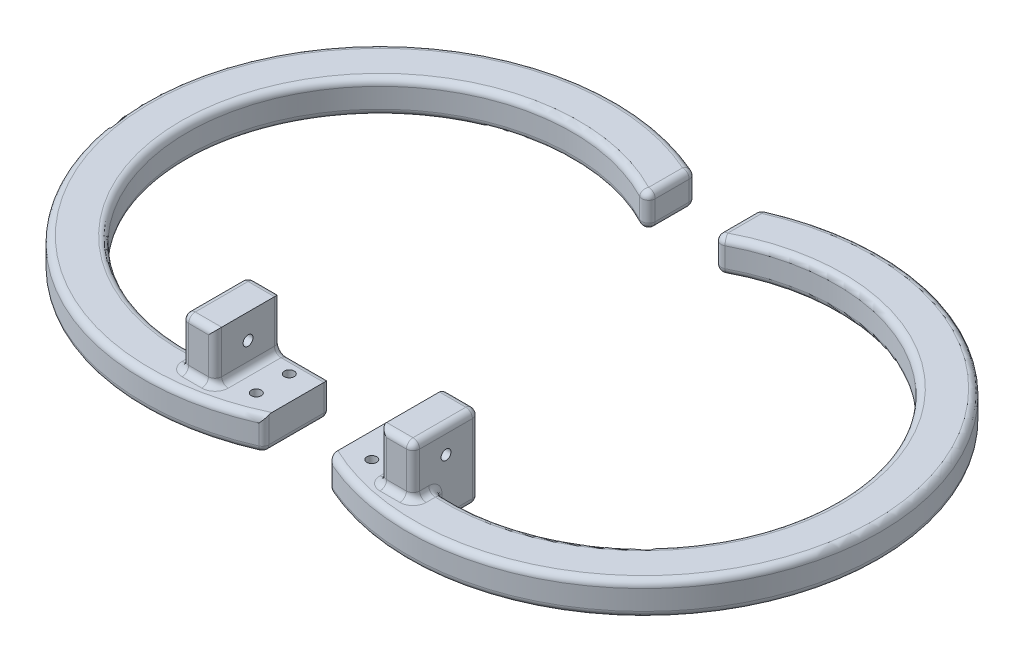
from build123d import *

# Parameters (mm, degrees)
BOSS_EXTRUDE1_DEPTH  = 10
SKETCH2_W            = 20
SKETCH2_H            = 10
BOSS_EXTRUDE2_DEPTH  = 15
SKETCH3_W            = 20
SKETCH3_H            = 15
BOSS_EXTRUDE10_DEPTH = 10
SKETCH4_W            = 10
SKETCH4_H            = 20
BOSS_EXTRUDE11_DEPTH = 10
FILLET2_R            = 2
SKETCH5_R            = 1.5
CUT_EXTRUDE1_DEPTH   = 112.385735788
CUT_EXTRUDE2_REACH   = 115.348
SKETCH6_R            = 1.5


with BuildPart() as part:
    # Sketch1 → Boss-Extrude1 (new body)
    with BuildSketch(Plane(origin=(0, 0, 0), x_dir=(1, 0, 0), z_dir=(0, 1, 0))):
        with BuildLine():
            Line((-20, 50), (-20, 65))
            ThreePointArc((-20, 65), (81.589105316, 0), (-20, -65))
            Line((-20, -65), (-20, -50))
            ThreePointArc((-20, -50), (68.309518948, 0), (-20, 50))
        make_face()
    extrude(amount=-BOSS_EXTRUDE1_DEPTH)

    # Sketch2 → Boss-Extrude2 (add)
    with BuildSketch(Plane.ZY.offset(20)):
        with Locations((55, -5)):
            Rectangle(SKETCH2_W, SKETCH2_H)
    extrude(amount=-BOSS_EXTRUDE2_DEPTH)



with BuildPart() as body_2:
    # Sketch3 → Boss-Extrude10 (new body)
    with BuildSketch(Plane(origin=(-5, 0, 0), x_dir=(0, 0, -1), z_dir=(1, 0, 0))):
        with Locations((-55, 7.5)):
            Rectangle(SKETCH3_W, SKETCH3_H)
    extrude(amount=BOSS_EXTRUDE10_DEPTH)


with BuildPart() as part_1:
    add(part.part)

    add(body_2.part)  # Boss-Extrude11 merges body 2
    # Sketch4 → Boss-Extrude11 (add)
    with BuildSketch(Plane(origin=(0, 0, 0), x_dir=(-1, 0, 0), z_dir=(0, -1, 0))):
        with Locations((0, -55)):
            Rectangle(SKETCH4_W, SKETCH4_H)
    extrude(amount=BOSS_EXTRUDE11_DEPTH)

    # Fillet2
    fillet2_edges = [part_1.edges().sort_by_distance(p)[0] for p in [
        (81.589105316, -10, 0),
        (-20, -10, -57.5),
        (-7.5, -10, 45),
        (-20, -5, 45),
        (5, -5, 58.094750193),
        (5, 2.5, 45),
        (66.809935353, -10, -13.138921005),
        (5, -10, 51.547375097),
        (-20, 0, -57.5),
        (81.589105316, 0, 0),
        (-12.5, 0, 45),
        (-5, 7.5, 45),
        (0, 15, 45),
        (-5, 7.5, 65),
        (0, 15, 65),
        (-5, 0, 55),
        (0, 0, 65),
        (5, 15, 55),
        (5, 7.5, 65),
        (5, 0, 61.547375097),
        (66.809935353, 0, -13.138921005),
        (-20, -10, 55),
        (-20, -5, -50),
        (-20, -5, -65),
        (-20, -5, 65),
    ]]
    fillet(fillet2_edges, radius=FILLET2_R)

    # Sketch5 → Cut-Extrude1 (cut, through all)
    with BuildSketch(Plane(origin=(0, 15, 0), x_dir=(1, 0, 0), z_dir=(0, 1, 0))):
        with Locations(Location((-12.5, -50, 0), (0, 0, 270))):
            Circle(SKETCH5_R)
        with Locations(Location((-12.5, -60, 0), (0, 0, 270))):
            Circle(SKETCH5_R)
    extrude(amount=-CUT_EXTRUDE1_DEPTH, mode=Mode.SUBTRACT)

    # Sketch6 → Cut-Extrude2 (cut, up to next)
    with BuildSketch(Plane.ZY.offset(5), mode=Mode.PRIVATE) as cut_extrude2_sk1:
        with Locations((55, 7.5)):
            Circle(SKETCH6_R)
    cut_extrude2_tool1 = extrude(cut_extrude2_sk1.sketch, amount=-CUT_EXTRUDE2_REACH, mode=Mode.PRIVATE) & part_1.part
    add(cut_extrude2_tool1.solids().sort_by_distance((-5, 7.5, 55))[0], mode=Mode.SUBTRACT)


with BuildPart() as body_2_2:
    # Mirror2: mirrored copy
    add(part_1.part.mirror(Plane.ZY.offset(30)))


solid = Compound([part_1.part, body_2_2.part])
